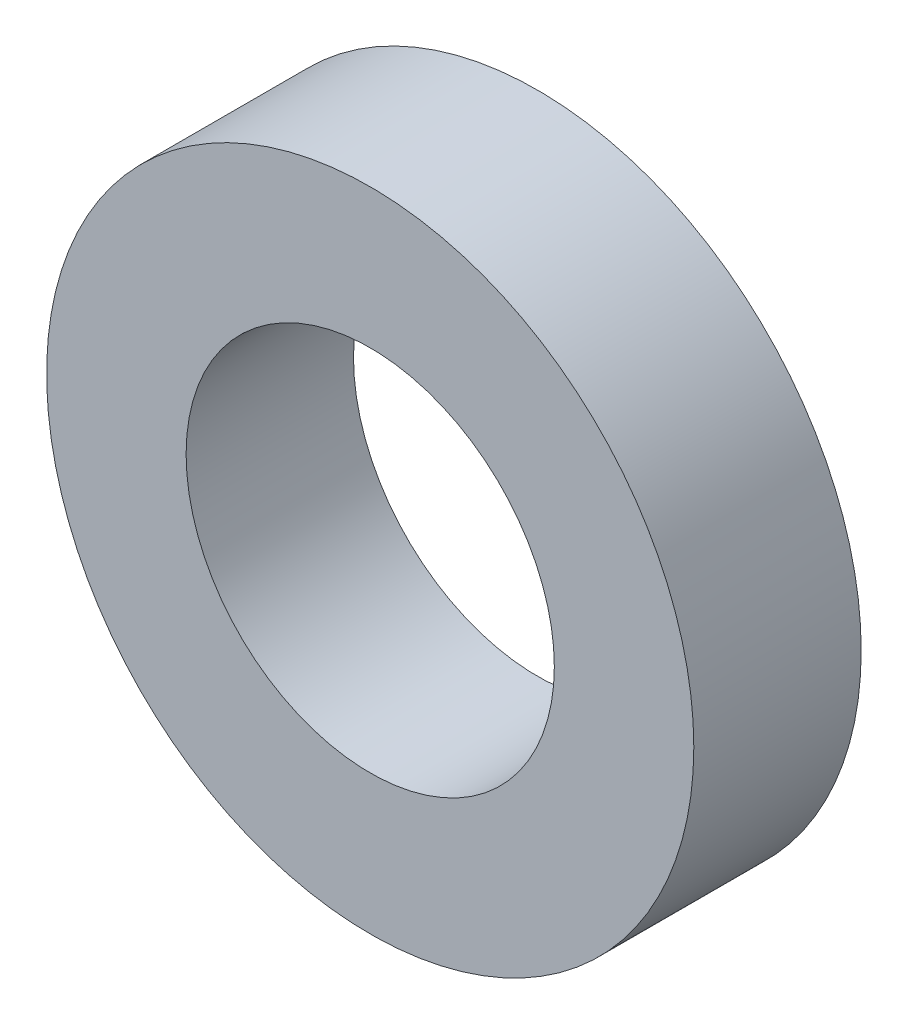
from build123d import *

# Parameters (mm, degrees)
SKETCH_1_R        = 2.9
SKETCH_1_R_2      = 1.65
M3_D3P3_1P5_DEPTH = 1.5


with BuildPart() as part:
    # 草图1 → M3安装垫片_D3p3_厚1p5 (new body)
    with BuildSketch(Plane.XY):
        Circle(SKETCH_1_R)
        Circle(SKETCH_1_R_2, mode=Mode.SUBTRACT)
    extrude(amount=M3_D3P3_1P5_DEPTH)


solid = part.part
